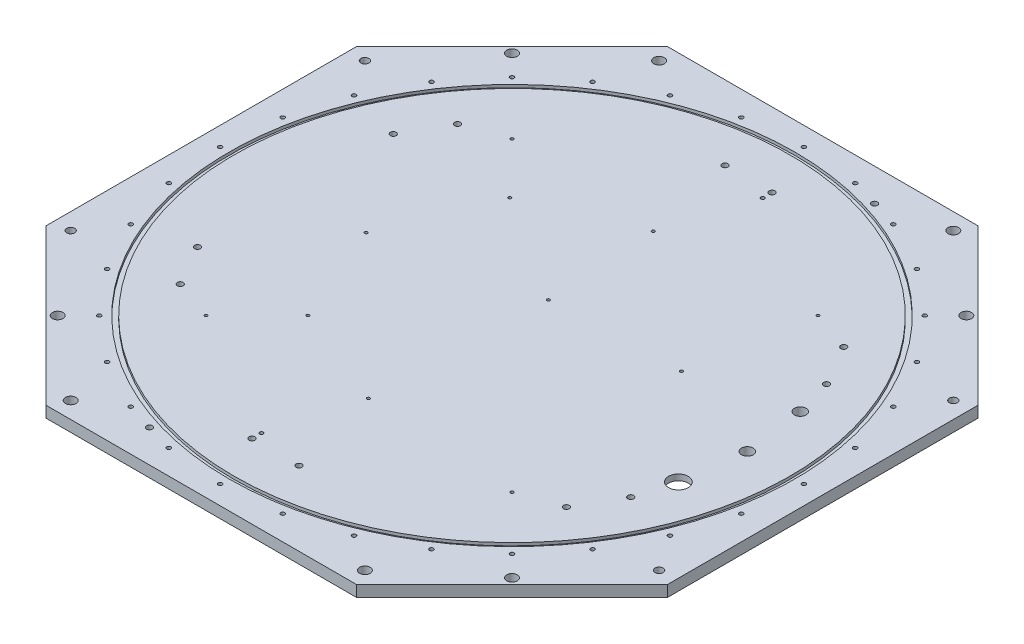
from build123d import *

# Parameters (mm, degrees)
BASE_PLATE_PROFILE_DEPTH                     = 4.7625
M3_CLEARANCE_HOLE_FOR_CYLINDER_D             = 3.4
M6X1_TAPPED_HOLE_FOR_SUPPORT_PILLARS_D       = 5
M6X1_TAPPED_HOLE_FOR_SUPPORT_PILLARS_DEPTH   = 6
M6X1_TAPPED_HOLE_FOR_SUPPORT_PILLARS_TIP     = 1.502151548
F_3_0MM_DOWEL_HOLE_FOR_SUPPORT_PILLARS_D     = 3
F_3_0MM_DOWEL_HOLE_FOR_SUPPORT_PILLARS_DEPTH = 6
F_3_0MM_DOWEL_HOLE_FOR_SUPPORT_PILLARS_TIP   = 0.901290929
M3X0_5_TAPPED_HOLE_FOR_PCB_STANDOFFS_D       = 2.5
M3X0_5_TAPPED_HOLE_FOR_PCB_STANDOFFS_DEPTH   = 6.5
M3X0_5_TAPPED_HOLE_FOR_PCB_STANDOFFS_TIP     = 0.751075774
M8_CLEARANCE_HOLE_FOR_LIFTING_ALIGNM_D       = 9
M8X1_25_TAPPED_HOLE_FOR_SUPER_STRUCTURE_D    = 6.8
F_7_16_20_TAPPED_HOLE_FOR_PENETRATOR_D       = 9.92124
SKETCH28_R                                   = 240.5
SKETCH28_R_2                                 = 236.3344
O_RING_GROOVE_DEPTH                          = 2.413
CIRPATTERN_EXTRACABLES_COUNT                 = 2
CIRPATTERN_EXTRACABLES_ANGLE                 = 15
F_5_8_CLEARANCE_HOLE1_D                      = 16.66748
SKETCH35_R                                   = 18
CUT_EXTRUDE1_DEPTH                           = 4.5
M8_CLEARANCE_HOLE_D                          = 9
F_5_0MM_DOWEL_HOLE1_D                        = 5.05
F_5_0MM_DOWEL_HOLE1_DEPTH                    = 5
F_5_0MM_DOWEL_HOLE1_TIP                      = 1.517173063


with BuildPart() as part:
    # Sketch1 → Base Plate Profile (new, symmetric)
    with BuildSketch(Plane(origin=(0, 0, 0), x_dir=(1, 0, 0), z_dir=(0, 1, 0))):
        Polygon((-131.979797464, 264), (131.979797464, 264), (264, 131.979797464), (264, -131.979797464), (131.979797464, -264), (-131.979797464, -264), (-264, -131.979797464), (-264, 131.979797464), align=None)
    extrude(amount=BASE_PLATE_PROFILE_DEPTH, both=True)

    # M3 Clearance Hole - For Cylinder (through all)
    with Locations(Plane(origin=(0, 4.7625, 0), x_dir=(1, 0, 0), z_dir=(0, 1, 0))):
        with Locations((248, 0), (243.23474954, -48.38239986), (229.122124063, -94.905491227), (206.204463851, -137.781417789), (175.362481734, -175.362481734), (137.781417789, -206.204463851), (94.905491227, -229.122124063), (48.38239986, -243.23474954), (0, -248), (-48.38239986, -243.23474954), (-94.905491227, -229.122124063), (-137.781417789, -206.204463851), (-175.362481734, -175.362481734), (-206.204463851, -137.781417789), (-229.122124063, -94.905491227), (-243.23474954, -48.38239986), (-248, 0), (-243.23474954, 48.38239986), (-229.122124063, 94.905491227), (-206.204463851, 137.781417789), (-175.362481734, 175.362481734), (-137.781417789, 206.204463851), (-94.905491227, 229.122124063), (-48.38239986, 243.23474954), (0, 248), (48.38239986, 243.23474954), (94.905491227, 229.122124063), (137.781417789, 206.204463851), (175.362481734, 175.362481734), (206.204463851, 137.781417789), (229.122124063, 94.905491227), (243.23474954, 48.38239986)):
            Hole(M3_CLEARANCE_HOLE_FOR_CYLINDER_D / 2)

    # M6x1 Tapped Hole - For Support Pillars
    with Locations(Plane(origin=(0, 4.7625, 0), x_dir=(1, 0, 0), z_dir=(0, 1, 0))):
        with Locations((-20, 201), (20, 201), (164.071106161, 117.820508076), (184.071106161, 83.179491924), (184.071106161, -83.179491924), (164.071106161, -117.820508076), (20, -201), (-20, -201), (-164.071106161, -117.820508076), (-184.071106161, -83.179491924), (-184.071106161, 83.179491924), (-164.071106161, 117.820508076)):
            Hole(M6X1_TAPPED_HOLE_FOR_SUPPORT_PILLARS_D / 2, depth=M6X1_TAPPED_HOLE_FOR_SUPPORT_PILLARS_DEPTH)
            with Locations((0, 0, -(M6X1_TAPPED_HOLE_FOR_SUPPORT_PILLARS_DEPTH + M6X1_TAPPED_HOLE_FOR_SUPPORT_PILLARS_TIP / 2))):  # 118° drill point
                Cone(0, M6X1_TAPPED_HOLE_FOR_SUPPORT_PILLARS_D / 2, M6X1_TAPPED_HOLE_FOR_SUPPORT_PILLARS_TIP, mode=Mode.SUBTRACT)

    # Ø3.0mm Dowel Hole - For Support Pillars
    with Locations(Plane(origin=(0, 4.7625, 0), x_dir=(1, 0, 0), z_dir=(0, 1, 0))):
        with Locations((20, 193), (-20, -193)):
            Hole(F_3_0MM_DOWEL_HOLE_FOR_SUPPORT_PILLARS_D / 2, depth=F_3_0MM_DOWEL_HOLE_FOR_SUPPORT_PILLARS_DEPTH)
            with Locations((0, 0, -(F_3_0MM_DOWEL_HOLE_FOR_SUPPORT_PILLARS_DEPTH + F_3_0MM_DOWEL_HOLE_FOR_SUPPORT_PILLARS_TIP / 2))):  # 118° drill point
                Cone(0, F_3_0MM_DOWEL_HOLE_FOR_SUPPORT_PILLARS_D / 2, F_3_0MM_DOWEL_HOLE_FOR_SUPPORT_PILLARS_TIP, mode=Mode.SUBTRACT)

    # M3x0.5 Tapped Hole - For PCB Standoffs
    with Locations(Plane(origin=(0, 4.7625, 0), x_dir=(1, 0, 0), z_dir=(0, 1, 0))):
        with Locations((113, 31), (-130, -130), (130, -130), (130, 130), (-130, 130), (-86.8, -86.7), (0, -122), (-123, -1), (-87.7, 85.8), (4, 27), (-2, 122)):
            Hole(M3X0_5_TAPPED_HOLE_FOR_PCB_STANDOFFS_D / 2, depth=M3X0_5_TAPPED_HOLE_FOR_PCB_STANDOFFS_DEPTH)
            with Locations((0, 0, -(M3X0_5_TAPPED_HOLE_FOR_PCB_STANDOFFS_DEPTH + M3X0_5_TAPPED_HOLE_FOR_PCB_STANDOFFS_TIP / 2))):  # 118° drill point
                Cone(0, M3X0_5_TAPPED_HOLE_FOR_PCB_STANDOFFS_D / 2, M3X0_5_TAPPED_HOLE_FOR_PCB_STANDOFFS_TIP, mode=Mode.SUBTRACT)

    # M8 Clearance Hole - For Lifting / Alignment (through all)
    with Locations(Plane(origin=(0, 4.7625, 0), x_dir=(1, 0, 0), z_dir=(0, 1, 0))):
        with Locations((-193.040151264, -193.040151264), (-193.040151264, 193.040151264), (193.040151264, 193.040151264), (193.040151264, -193.040151264)):
            Hole(M8_CLEARANCE_HOLE_FOR_LIFTING_ALIGNM_D / 2)

    # M8x1.25 Tapped Hole -For Super Structure (through all)
    with Locations(Plane(origin=(0, 4.7625, 0), x_dir=(1, 0, 0), z_dir=(0, 1, 0))):
        with Locations((250, 125), (-250, -125), (-250, 125), (250, -125)):
            Hole(M8X1_25_TAPPED_HOLE_FOR_SUPER_STRUCTURE_D / 2)

    # 7/16-20 Tapped Hole - For Penetrator (through all)
    with Locations(Plane(origin=(0, -4.7625, 0), x_dir=(-1, 0, 0), z_dir=(0, -1, 0))):
        with Locations((-200, 0)):
            f_7_16_20_tapped_hole_for_penetrator = Hole(F_7_16_20_TAPPED_HOLE_FOR_PENETRATOR_D / 2)

    # Sketch28 → O-ring Groove (cut)
    with BuildSketch(Plane(origin=(0, 4.7625, 0), x_dir=(1, 0, 0), z_dir=(0, 1, 0))):
        with Locations(Location((0, 0, 0), (0, 0, 270))):
            Circle(SKETCH28_R)
        with Locations(Location((0, 0, 0), (0, 0, 270))):
            Circle(SKETCH28_R_2, mode=Mode.SUBTRACT)
    extrude(amount=-O_RING_GROOVE_DEPTH, mode=Mode.SUBTRACT)

    # CirPattern_extraCables: 7/16-20 Tapped Hole - For Penetrator ×2 about axis
    cirpattern_extracables_axis = Axis((0, -5.23875, 0), (0, 1, 0))
    for i in range(1, CIRPATTERN_EXTRACABLES_COUNT):
        add(f_7_16_20_tapped_hole_for_penetrator.rotate(cirpattern_extracables_axis, i * CIRPATTERN_EXTRACABLES_ANGLE / (CIRPATTERN_EXTRACABLES_COUNT - 1)), mode=Mode.SUBTRACT)

    # 5/8 Clearance Hole1 (through all)
    with Locations(Plane(origin=(0, 4.7625, 0), x_dir=(1, 0, 0), z_dir=(0, 1, 0))):
        with Locations((193.185165258, -51.763809021)):
            Hole(F_5_8_CLEARANCE_HOLE1_D / 2)

    # Sketch35 → Cut-Extrude1 (cut)
    with BuildSketch(Plane.XZ.offset(4.7625)):
        with Locations(Location((193.185165258, 51.763809021, 0), (0, 0, 270))):
            Circle(SKETCH35_R)
    extrude(amount=-CUT_EXTRUDE1_DEPTH, mode=Mode.SUBTRACT)

    # M8 Clearance Hole (through all)
    with Locations(Plane(origin=(-28.123925909, 4.7625, -48.06749493), x_dir=(1, 0, 0), z_dir=(0, 1, 0))):
        with Locations((-96.876074091, -298.06749493), (-96.876074091, 201.93250507), (153.123925909, -298.06749493), (153.123925909, 201.93250507)):
            Hole(M8_CLEARANCE_HOLE_D / 2)

    # Ø5.0mm Dowel Hole1
    with Locations(Plane(origin=(0, 4.7625, 0), x_dir=(1, 0, 0), z_dir=(0, 1, 0))):
        with Locations((71.700315282, 236.364262926), (-71.700315282, -236.364262926)):
            Hole(F_5_0MM_DOWEL_HOLE1_D / 2, depth=F_5_0MM_DOWEL_HOLE1_DEPTH)
            with Locations((0, 0, -(F_5_0MM_DOWEL_HOLE1_DEPTH + F_5_0MM_DOWEL_HOLE1_TIP / 2))):  # 118° drill point
                Cone(0, F_5_0MM_DOWEL_HOLE1_D / 2, F_5_0MM_DOWEL_HOLE1_TIP, mode=Mode.SUBTRACT)


solid = part.part
